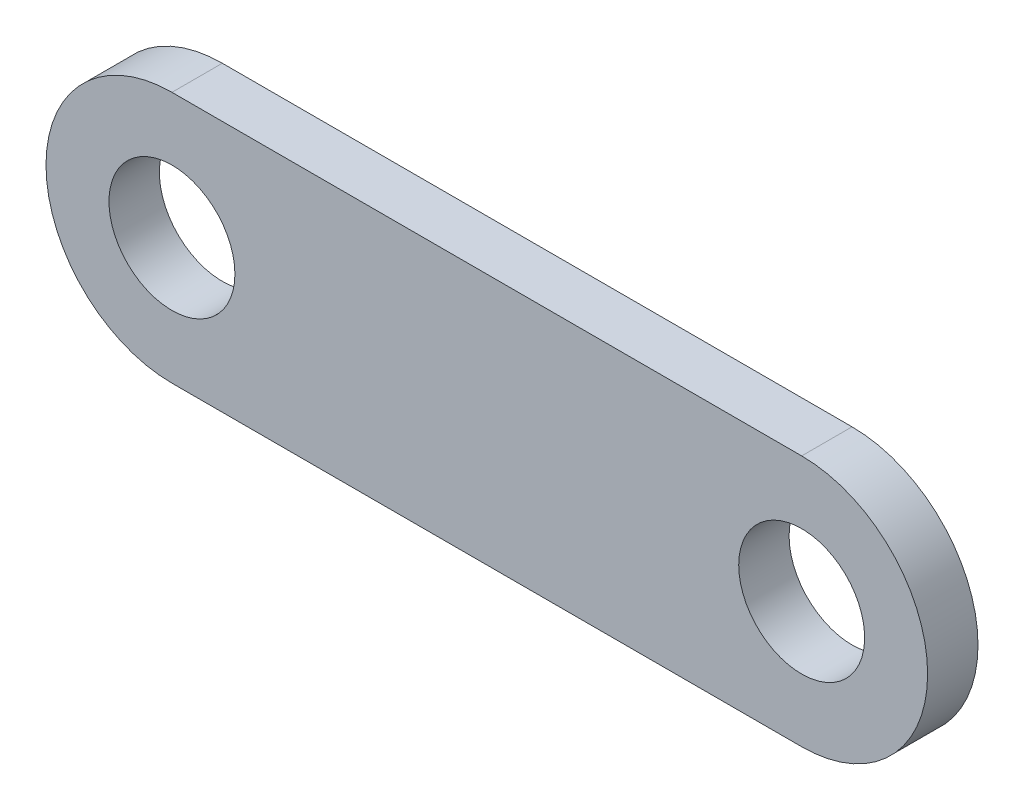
from build123d import *

# Parameters (mm, degrees)
SKETCH1_R           = 25
BOSS_EXTRUDE1_DEPTH = 20


with BuildPart() as part:
    # Sketch1 → Boss-Extrude1 (new body)
    with BuildSketch(Plane.XY):
        with BuildLine():
            Line((125, -50), (-125, -50))
            ThreePointArc((-125, -50), (-175, 0), (-125, 50))
            Line((-125, 50), (125, 50))
            ThreePointArc((125, 50), (175, 0), (125, -50))
        make_face()
        with Locations((-125, 0)):
            Circle(SKETCH1_R, mode=Mode.SUBTRACT)
        with Locations(Location((125, 0, 0), (0, 0, 180))):
            Circle(SKETCH1_R, mode=Mode.SUBTRACT)
    extrude(amount=BOSS_EXTRUDE1_DEPTH)


solid = part.part
